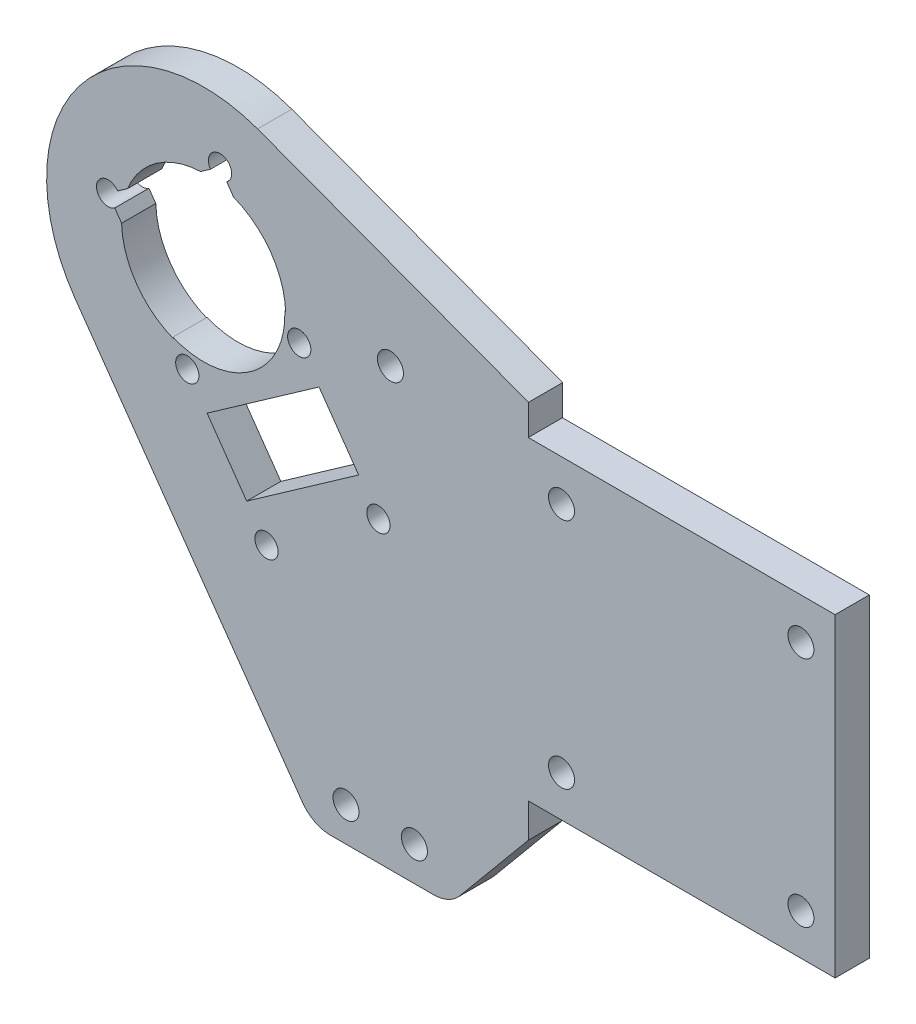
from build123d import *
from build123d.topology import SkipClean

# Parameters (mm, degrees)
ESQUISSE1_R         = 1.9
ESQUISSE1_R_2       = 1.950000027
BOSS_EXTRU_1_DEPTH  = 5
EXTRUDE_1_DEPTH     = 5
CUT_EXTRUDE_1_DEPTH = 5
CUT_EXTRUDE_2_DEPTH = 5
EXTRUDE_3_DEPTH     = 5
SKETCH_5_W          = 35
SKETCH_5_H          = 46
EXTRUDE_4_DEPTH     = 5
CUT_EXTRUDE_START   = -5
SKETCH_6_R          = 1.9
CUT_EXTRUDE_3_DEPTH = 5


with BuildPart() as part:
    # Esquisse1 → Boss.-Extru.1 (new body)
    with BuildSketch(Plane.XY):
        with BuildLine():
            Line((-36.042079519, 6.612329971), (-2.756888739, -40.60806749))
            ThreePointArc((-2.756888739, -40.60806749), (-0.971927818, -42.166026475), (1.329860158, -42.727358644))
            Line((1.329860158, -42.727358644), (16.414744778, -42.727358644))
            ThreePointArc((16.414744778, -42.727358644), (18.537962215, -42.254161899), (20.25929982, -40.92413773))
            Line((20.25929982, -40.92413773), (30.250474641, -28.908411747))
            Line((30.250474641, -28.908411747), (30.250474641, -23.914585762))
            Line((30.250474641, -23.914585762), (40.110474641, -23.914585762))
            Line((40.110474641, -23.914585762), (40.110474641, 22.085414238))
            Line((40.110474641, 22.085414238), (30.250474641, 22.085414238))
            Line((30.250474641, 22.085414238), (30.289127967, 26.563728114))
            Line((30.289127967, 26.563728114), (-9.322024272, 41.369413347))
            ThreePointArc((-9.322024272, 41.369413347), (-35.395503084, 33.764537489), (-36.042079519, 6.612329971))
        make_face()
        with Locations((-29.585096552, 28.740581162)):
            Circle(ESQUISSE1_R, mode=Mode.SUBTRACT)
        with Locations((-21.4008614, 34.486736198)):
            Circle(ESQUISSE1_R, mode=Mode.SUBTRACT)
        with Locations((-1.428936876, -11.362171084)):
            Circle(ESQUISSE1_R_2, mode=Mode.SUBTRACT)
        with Locations((6.755298276, -5.616016048)):
            Circle(ESQUISSE1_R_2, mode=Mode.SUBTRACT)
        with Locations((10.104149324, 21.053484932)):
            Circle(ESQUISSE1_R, mode=Mode.SUBTRACT)
        with Locations((3.608581782, -37.743606202)):
            Circle(ESQUISSE1_R, mode=Mode.SUBTRACT)
        with Locations((13.608573866, -37.73091599)):
            Circle(ESQUISSE1_R, mode=Mode.SUBTRACT)
        with Locations((35.110474641, -17.914585762)):
            Circle(ESQUISSE1_R, mode=Mode.SUBTRACT)
        with Locations((35.110474641, 16.085214419)):
            Circle(ESQUISSE1_R, mode=Mode.SUBTRACT)
        with BuildLine():
            Line((-14.809164556, 33.799672662), (-20.660891689, 29.691172522))
            ThreePointArc((-20.660891689, 29.691172522), (-22.18628804, 29.363713126), (-23.482781796, 30.231565432))
            Line((-23.482781796, 30.231565432), (-25.924897053, 33.709865414))
            ThreePointArc((-25.924897053, 33.709865414), (-26.47826462, 34.0839702), (-27.131559209, 33.944771651))
            ThreePointArc((-27.131559209, 33.944771651), (-27.478774003, 33.409530528), (-27.357701898, 32.783125931))
            Line((-27.357701898, 32.783125931), (-24.915585604, 29.304825893))
            ThreePointArc((-24.915585604, 29.304825893), (-24.495010021, 27.771470128), (-25.32590655, 26.415861527))
            Line((-25.32590655, 26.415861527), (-31.177633683, 22.307361387))
            Line((-31.177633683, 22.307361387), (-8.020629273, -10.675105791))
            Line((-8.020629273, -10.675105791), (-2.16890246, -6.566605875))
            ThreePointArc((-2.16890246, -6.566605875), (-0.674874752, -6.233398064), (0.617175813, -7.054221782))
            Line((0.617175813, -7.054221782), (3.05929141, -10.532521451))
            ThreePointArc((3.05929141, -10.532521451), (3.608413847, -10.881372123), (4.243376724, -10.739758611))
            ThreePointArc((4.243376724, -10.739758611), (4.592227421, -10.190636157), (4.450613892, -9.555673255))
            Line((4.450613892, -9.555673255), (2.008497767, -6.077373005))
            ThreePointArc((2.008497767, -6.077373005), (1.675290093, -4.583345549), (2.496113536, -3.291295137))
            Line((2.496113536, -3.291295137), (8.347839718, 0.817205678))
            Line((8.347839718, 0.817205678), (-14.809164556, 33.799672662))
        make_face(mode=Mode.SUBTRACT)
    extrude(amount=BOSS_EXTRU_1_DEPTH)

    # 草图1 → 凸台-拉伸1 (add)
    with BuildSketch(Plane.XY.offset(5)):
        Polygon((-31.177633683, 22.307361387), (-35.97039471, 29.133678309), (-19.693347321, 40.561802618), (-14.809164556, 33.799672662), align=None)
        Polygon((-8.020629273, -10.675105791), (8.347839718, 0.817205678), (13.184422938, -6.071527079), (-3.384378671, -17.704492194), align=None)
    extrude(amount=-EXTRUDE_1_DEPTH)

    # 草图2 → 切除-拉伸1 (cut)
    with BuildSketch(Plane.XY.offset(5)):
        with BuildLine():
            Line((-30.200787341, 20.916041429), (-31.177633683, 22.307361387))
            Line((-31.177633683, 22.307361387), (-29.786313807, 23.284207845))
            ThreePointArc((-29.786313807, 23.284207845), (-32.852180144, 22.600438421), (-30.200787341, 20.916041429))
        make_face()
        with BuildLine():
            Line((-16.200484514, 32.82282632), (-14.809164556, 33.799672662))
            Line((-14.809164556, 33.799672662), (-13.832318214, 32.408352704))
            ThreePointArc((-13.832318214, 32.408352704), (-13.30074837, 33.015656967), (-13.109164556, 33.799672662))
            ThreePointArc((-13.109164556, 33.799672662), (-15.321393056, 35.42066679), (-16.200484514, 32.82282632))
        make_face()
        with BuildLine():
            Line((-4.207508761, 18.699759128), (-3.230662419, 17.30843917))
            Line((-3.230662419, 17.30843917), (-2.253816078, 15.917119212))
            ThreePointArc((-2.253816078, 15.917119212), (-1.722246233, 16.524423475), (-1.530662419, 17.30843917))
            ThreePointArc((-1.530662419, 17.30843917), (-2.446646724, 18.816855356), (-4.207508761, 18.699759128))
        make_face()
        with BuildLine():
            Line((-19.599131478, 5.816127798), (-20.57597782, 7.207447756))
            ThreePointArc((-20.57597782, 7.207447756), (-20.990451436, 4.839281457), (-18.622285137, 4.42480784))
            Line((-18.622285137, 4.42480784), (-19.599131478, 5.816127798))
        make_face()
        with BuildLine():
            Line((-8.020629273, -10.675105791), (-8.997475615, -9.283785833))
            ThreePointArc((-8.997475615, -9.283785833), (-8.804644968, -12.183521977), (-6.320629273, -10.675105791))
            ThreePointArc((-6.320629273, -10.675105791), (-6.399635145, -10.162877291), (-6.629309315, -9.698259449))
            Line((-6.629309315, -9.698259449), (-8.020629273, -10.675105791))
        make_face()
        with BuildLine():
            ThreePointArc((-6.629309315, -9.698259449), (-7.727552169, -9.000559341), (-8.997475615, -9.283785833))
            Line((-8.997475615, -9.283785833), (-8.020629273, -10.675105791))
            Line((-8.020629273, -10.675105791), (-6.629309315, -9.698259449))
        make_face()
        with BuildLine():
            Line((8.347839718, 0.817205678), (7.370993376, 2.208525636))
            ThreePointArc((7.370993376, 2.208525636), (6.673293247, 1.110282658), (6.956519906, -0.159640871))
            Line((6.956519906, -0.159640871), (8.347839718, 0.817205678))
        make_face()
        with BuildLine():
            ThreePointArc((10.047839718, 0.817205678), (9.131855413, 2.325621864), (7.370993376, 2.208525636))
            Line((7.370993376, 2.208525636), (8.347839718, 0.817205678))
            Line((8.347839718, 0.817205678), (6.956519906, -0.159640871))
            ThreePointArc((6.956519906, -0.159640871), (8.860068338, -0.803788412), (10.047839718, 0.817205678))
        make_face()
    extrude(amount=-CUT_EXTRUDE_1_DEPTH, mode=Mode.SUBTRACT)

    # 草图3 → 切除-拉伸2 (cut)
    with BuildSketch(Plane.XY.offset(5)):
        with BuildLine():
            Line((-21.576815105, 8.632937959), (-29.199951088, 19.490552697))
            ThreePointArc((-29.199951088, 19.490552697), (-27.025230106, 12.912514338), (-21.576815105, 8.632937959))
        make_face()
        with BuildLine():
            ThreePointArc((-28.328515046, 24.307729049), (-28.734520323, 23.132131809), (-29.016664647, 21.920825185))
            Line((-29.016664647, 21.920825185), (-5.391631455, 17.694975372))
            ThreePointArc((-5.391631455, 17.694975372), (-5.251110798, 18.747287049), (-5.204148051, 19.807900278))
            ThreePointArc((-5.204148051, 19.807900278), (-5.205197337, 19.966587945), (-5.208345014, 20.12524786))
            Line((-5.208345014, 20.12524786), (-12.831480997, 30.982862597))
            ThreePointArc((-12.831480997, 30.982862597), (-15.202807683, 31.639833203), (-17.658285182, 31.799303844))
            Line((-17.658285182, 31.799303844), (-20.660891689, 29.691172522))
            Line((-20.660891689, 29.691172522), (-25.325906895, 26.415862018))
            Line((-25.325906895, 26.415862018), (-28.328515046, 24.307729049))
        make_face()
        with BuildLine():
            ThreePointArc((-17.658285182, 31.799303844), (-24.099535109, 29.628981549), (-28.328515046, 24.307729049))
            Line((-28.328515046, 24.307729049), (-25.325906895, 26.415862018))
            Line((-25.325906895, 26.415862018), (-20.660891689, 29.691172522))
            Line((-20.660891689, 29.691172522), (-17.658285182, 31.799303844))
        make_face()
        with BuildLine():
            Line((-12.831480997, 30.982862597), (-5.208345014, 20.12524786))
            ThreePointArc((-5.208345014, 20.12524786), (-7.383065996, 26.703286219), (-12.831480997, 30.982862597))
        make_face()
    extrude(amount=-CUT_EXTRUDE_2_DEPTH, mode=Mode.SUBTRACT)

    # 草图4 → 凸台-拉伸3 (add)
    with SkipClean():  # the faces are left unmerged after this step: merging them gives an invalid solid
        with BuildSketch(Plane.XY.offset(5)):
            with BuildLine():
                ThreePointArc((-5.339316546, 20.311790307), (-10.38028646, 10.088690187), (-21.707786637, 8.819480406))
                Line((-21.707786637, 8.819480406), (-20.57597782, 7.207447756))
                ThreePointArc((-20.57597782, 7.207447756), (-18.20781152, 6.79297414), (-18.622285137, 4.42480784))
                Line((-18.622285137, 4.42480784), (-16.704506194, 1.693319781))
                Line((-16.704506194, 1.693319781), (-12.612388659, 4.566397265))
                Line((-12.612388659, 4.566397265), (-0.336036876, 13.185630785))
                Line((-0.336036876, 13.185630785), (-2.253816078, 15.917119212))
                ThreePointArc((-2.253816078, 15.917119212), (-4.621982377, 16.331592828), (-4.207508761, 18.699759128))
                Line((-4.207508761, 18.699759128), (-5.339316546, 20.311790307))
            make_face()
            with BuildLine():
                Line((5.453214175, 4.940014063), (-10.915254816, -6.552297405))
                Line((-10.915254816, -6.552297405), (-8.997475615, -9.283785833))
                ThreePointArc((-8.997475615, -9.283785833), (-7.727552249, -9.000559327), (-6.629309409, -9.698259316))
                Line((-6.629309409, -9.698259316), (6.956519854, -0.159640797))
                ThreePointArc((6.956519854, -0.159640797), (6.673293255, 1.110282702), (7.370993376, 2.208525636))
                Line((7.370993376, 2.208525636), (5.453214175, 4.940014063))
            make_face()
        extrude(amount=-EXTRUDE_3_DEPTH)

    # 草图5 → 凸台-拉伸4 (add)
    with SkipClean():  # the faces are left unmerged after this step: merging them gives an invalid solid
        with BuildSketch(Plane.XY.offset(5)):
            with Locations((57.610474641, -0.914585762)):
                Rectangle(SKETCH_5_W, SKETCH_5_H)
        extrude(amount=-EXTRUDE_4_DEPTH)

    # 草图6 → 切除-拉伸3 (cut)
    with SkipClean():  # the faces are left unmerged after this step: merging them gives an invalid solid
        with BuildSketch(Plane.XY.offset(5).offset(CUT_EXTRUDE_START)):
            with Locations((35.110474641, 16.085214419)):
                Circle(SKETCH_6_R)
            with Locations((70.110474641, 16.085214419)):
                Circle(SKETCH_6_R)
            with Locations((35.110474641, -17.914585762)):
                Circle(SKETCH_6_R)
            with Locations((70.110474641, -17.914585762)):
                Circle(SKETCH_6_R)
        extrude(amount=CUT_EXTRUDE_3_DEPTH, mode=Mode.SUBTRACT)


solid = part.part
